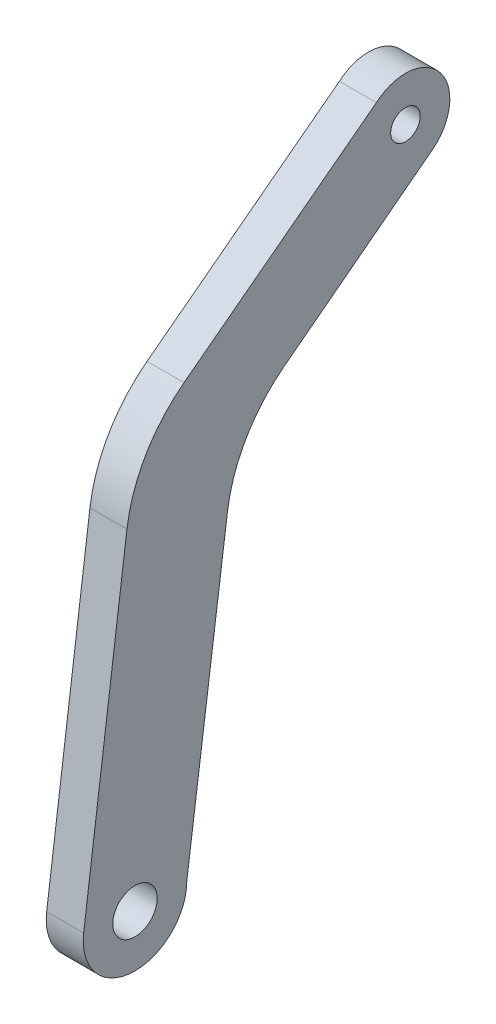
from build123d import *

# Parameters (mm, degrees)
SKETCH_1_R      = 2
SKETCH_1_R_2    = 3
EXTRUDE_1_DEPTH = 5


with BuildPart() as part:
    # Эскиз1 → Вытянуть1 (new body)
    with BuildSketch(Plane(origin=(0, 0, 0), x_dir=(0, 0, -1), z_dir=(1, 0, 0))):
        with BuildLine():
            Line((7.575683133, -1.440115884), (-12.469484281, -16.781905188))
            ThreePointArc((-12.469484281, -16.781905188), (-17.607820026, -22.618098146), (-20.13202497, -29.972826683))
            Line((-20.13202497, -29.972826683), (-25.633699378, -70.487183266))
            ThreePointArc((-25.633699378, -70.487183266), (-33.092432219, -77.472135963), (-39.573574859, -69.571689784))
            Line((-39.573574859, -69.571689784), (-33.723342294, -25.224147921))
            ThreePointArc((-33.723342294, -25.224147921), (-31.193364371, -17.801369037), (-26.003850091, -11.921966331))
            Line((-26.003850091, -11.921966331), (0, 7.859153004))
            ThreePointArc((0, 7.859153004), (8.580790261, 7.114111601), (7.575683133, -1.440115884))
        make_face()
        with Locations((3.929013193, 3.324524538)):
            Circle(SKETCH_1_R, mode=Mode.SUBTRACT)
        with Locations((-32.633699378, -70.487183266)):
            Circle(SKETCH_1_R_2, mode=Mode.SUBTRACT)
    extrude(amount=EXTRUDE_1_DEPTH)


solid = part.part
